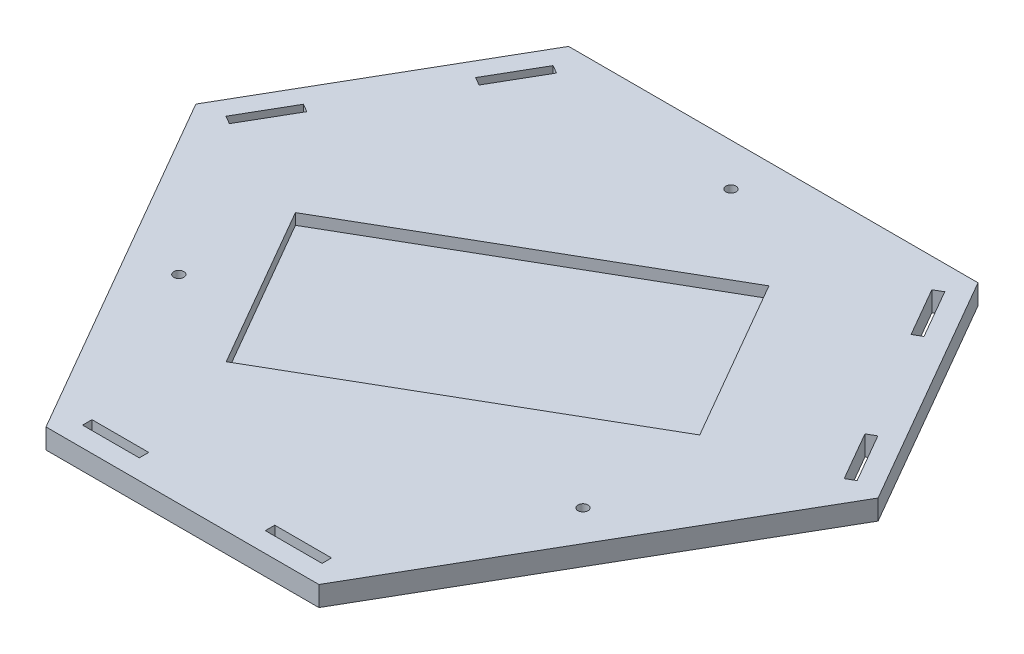
from build123d import *

# Parameters (mm, degrees)
BOSS_EXTRUDE1_DEPTH = 6.35
SKETCH2_W           = 18
SKETCH2_H           = 3
CUT_EXTRUDE1_DEPTH  = 148.509567486
CUT_EXTRUDE2_DEPTH  = 3.5
SKETCH8_R           = 1.6
CUT_EXTRUDE3_DEPTH  = 148.509567486


with BuildPart() as part:
    # Sketch1 → Boss-Extrude1 (new body)
    with BuildSketch(Plane(origin=(0, 0, 0), x_dir=(1, 0, 0), z_dir=(0, 1, 0))):
        Polygon((64.951905284, 87.5), (-64.951905284, 87.5), (-108.253175473, 12.5), (-43.301270189, -100), (43.301270189, -100), (108.253175473, 12.5), align=None)
    extrude(amount=BOSS_EXTRUDE1_DEPTH)

    # Sketch2 → Cut-Extrude1 (cut, through all)
    with BuildSketch(Plane(origin=(0, 6.35, 0), x_dir=(1, 0, 0), z_dir=(0, 1, 0))):
        with Locations((-29, -92.2)):
            Rectangle(SKETCH2_W, SKETCH2_H)
        with Locations((29, -92.2)):
            Rectangle(SKETCH2_W, SKETCH2_H)
        Polygon((-62.146580335, 79.758965344), (-59.548504123, 78.258965344), (-68.548504123, 62.670508076), (-71.146580335, 64.170508076), align=None)
        Polygon((-97.548504123, 12.441034656), (-88.548504123, 28.029491924), (-91.146580335, 29.529491924), (-100.146580335, 13.941034656), align=None)
        Polygon((100.146580335, 13.941034656), (91.146580335, 29.529491924), (88.548504123, 28.029491924), (97.548504123, 12.441034656), align=None)
        Polygon((59.548504123, 78.258965344), (62.146580335, 79.758965344), (71.146580335, 64.170508076), (68.548504123, 62.670508076), align=None)
    extrude(amount=-CUT_EXTRUDE1_DEPTH, mode=Mode.SUBTRACT)

    # Sketch4 → Cut-Extrude2 (cut)
    with BuildSketch(Plane(origin=(0, 6.35, 0), x_dir=(1, 0, 0), z_dir=(0, 1, 0))):
        Polygon((-62.631397208, -1.519237886), (32.631397208, 53.480762114), (62.631397208, 1.519237886), (-32.631397208, -53.480762114), align=None)
    extrude(amount=-CUT_EXTRUDE2_DEPTH, mode=Mode.SUBTRACT)

    # Sketch8 → Cut-Extrude3 (cut, through all)
    with BuildSketch(Plane(origin=(0, 6.35, 0), x_dir=(1, 0, 0), z_dir=(0, 1, 0))):
        with Locations((-64.137841404, -37.03)):
            Circle(SKETCH8_R)
        with Locations((64.137841404, -37.03)):
            Circle(SKETCH8_R)
        with Locations((0, 74.06)):
            Circle(SKETCH8_R)
    extrude(amount=-CUT_EXTRUDE3_DEPTH, mode=Mode.SUBTRACT)


solid = part.part
